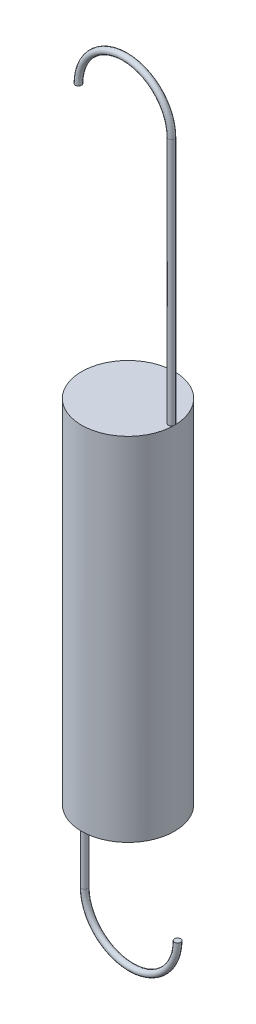
from build123d import *

# Parameters (mm, degrees)
SKETCH1_R           = 3
BOSS_EXTRUDE1_DEPTH = 22.7
SKETCH3_R           = 0.2
SKETCH5_R           = 0.2


with BuildPart() as part:
    # Sketch1 → Boss-Extrude1 (new body)
    with BuildSketch(Plane(origin=(0, 0, 0), x_dir=(1, 0, 0), z_dir=(0, 1, 0))):
        with Locations(Location((0, 0, 0), (0, 0, 270))):
            Circle(SKETCH1_R)
    extrude(amount=BOSS_EXTRUDE1_DEPTH)

    # Sweep1: sweep along a path in Sketch2
    with BuildLine(Plane.XY) as sweep1_path:
        Line((2.8, 22.7), (2.8, 38.7))
        ThreePointArc((2.8, 38.7), (-0.2, 41.7), (-3.2, 38.7))
    # Sketch3 → Sweep1 (sweep)
    with BuildSketch(Plane(origin=(0, 22.7, 0), x_dir=(1, 0, 0), z_dir=(0, 1, 0))):
        with Locations((2.8, 0)):
            Circle(SKETCH3_R)
    sweep(path=sweep1_path.line)

    # Sweep2: sweep along a path in Sketch4
    with BuildLine(Plane.XY) as sweep2_path:
        Line((-2.8, 0), (-2.8, -6))
        ThreePointArc((-2.8, -6), (0.2, -9), (3.2, -6))
    # Sketch5 → Sweep2 (sweep)
    with BuildSketch(Plane.XZ):
        with Locations((-2.8, 0)):
            Circle(SKETCH5_R)
    sweep(path=sweep2_path.line)


solid = part.part
